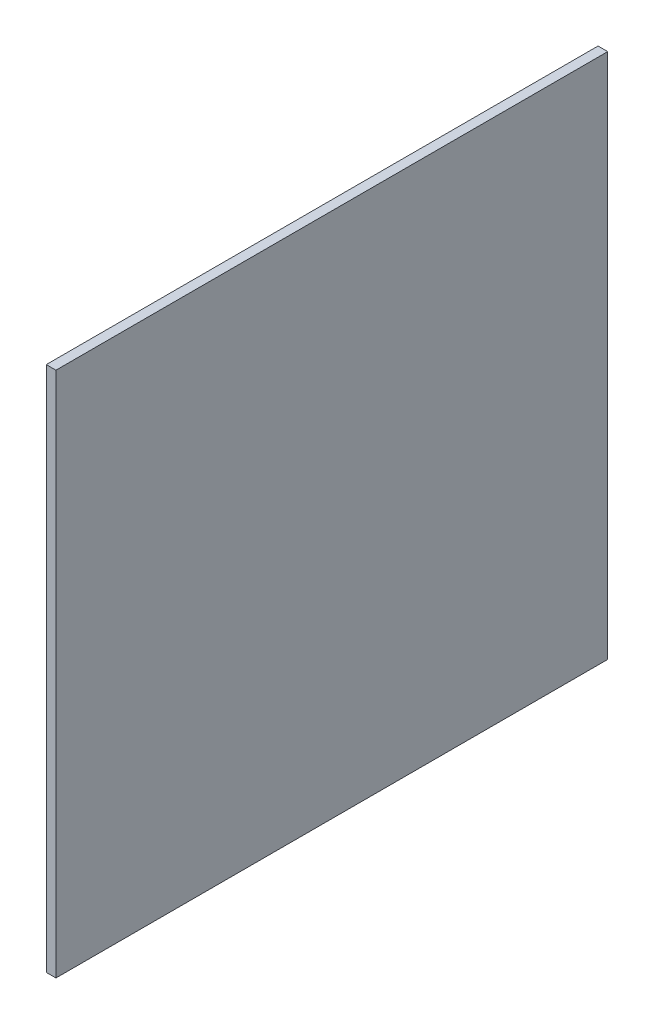
from build123d import *

# Parameters (mm, degrees)
SKETCH_1_W        = 91.2
SKETCH_1_H        = 87
EXTRUDE_334_DEPTH = 0.8


with BuildPart() as part:
    # ｽｹｯﾁ1 → Extrude 334 (new, symmetric)
    with BuildSketch(Plane(origin=(0, 0, 0), x_dir=(0, 0, -1), z_dir=(1, 0, 0))):
        with Locations((0, 43.5)):
            Rectangle(SKETCH_1_W, SKETCH_1_H)
    extrude(amount=EXTRUDE_334_DEPTH, both=True)


solid = part.part
